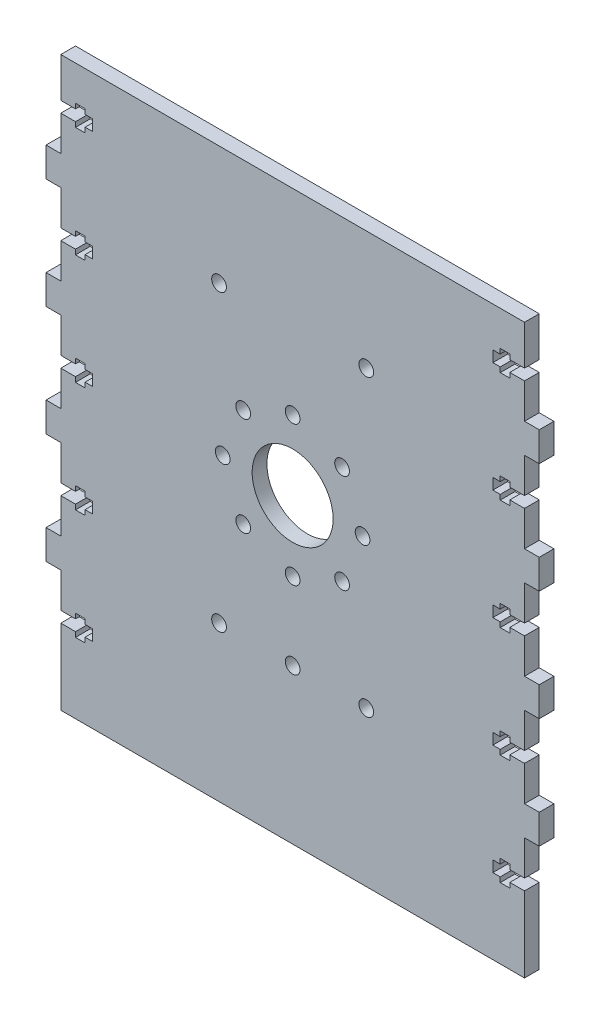
from build123d import *

# Parameters (mm, degrees)
SKETCH_1_R          = 2
SKETCH_1_R_2        = 11
EXTRUDE_1_DEPTH     = 4
SKETCH_3_W          = 126
SKETCH_3_H          = 2.7
CUT_EXTRUDE_1_DEPTH = 10


with BuildPart() as part:
    # 草图1 → 凸台-拉伸1 (new body)
    with BuildSketch(Plane.XY):
        Polygon((145, 46.5), (149, 46.5), (149, 45.15), (151.6, 45.15), (151.6, 46.5), (153.6, 46.5), (153.6, 49.5), (151.6, 49.5), (151.6, 50.85), (149, 50.85), (149, 49.5), (145, 49.5), (145, 59), (141, 59), (141, 67), (145, 67), (145, 76.5), (149, 76.5), (149, 75.15), (151.6, 75.15), (151.6, 76.5), (153.6, 76.5), (153.6, 79.5), (151.6, 79.5), (151.6, 80.85), (149, 80.85), (149, 79.5), (145, 79.5), (145, 89), (141, 89), (141, 97), (145, 97), (145, 106.5), (149, 106.5), (149, 105.15), (151.6, 105.15), (151.6, 106.5), (153.6, 106.5), (153.6, 109.5), (151.6, 109.5), (151.6, 110.85), (149, 110.85), (149, 109.5), (145, 109.5), (145, 123), (271, 123), (271, 109.5), (267, 109.5), (267, 110.85), (264.4, 110.85), (264.4, 109.5), (262.4, 109.5), (262.4, 106.5), (264.4, 106.5), (264.4, 105.15), (267, 105.15), (267, 106.5), (271, 106.5), (271, 97), (275, 97), (275, 89), (271, 89), (271, 79.5), (267, 79.5), (267, 80.85), (264.4, 80.85), (264.4, 79.5), (262.4, 79.5), (262.4, 76.5), (264.4, 76.5), (264.4, 75.15), (267, 75.15), (267, 76.5), (271, 76.5), (271, 67), (275, 67), (275, 59), (271, 59), (271, 49.5), (267, 49.5), (267, 50.85), (264.4, 50.85), (264.4, 49.5), (262.4, 49.5), (262.4, 46.5), (264.4, 46.5), (264.4, 45.15), (267, 45.15), (267, 46.5), (271, 46.5), (271, 37), (275, 37), (275, 29), (271, 29), (271, 19.5), (267, 19.5), (267, 20.85), (264.4, 20.85), (264.4, 19.5), (262.4, 19.5), (262.4, 16.5), (264.4, 16.5), (264.4, 15.15), (267, 15.15), (267, 16.5), (271, 16.5), (271, 7), (275, 7), (275, -1), (271, -1), (271, -10.5), (267, -10.5), (267, -9.15), (264.4, -9.15), (264.4, -10.5), (262.4, -10.5), (262.4, -13.5), (264.4, -13.5), (264.4, -14.85), (267, -14.85), (267, -13.5), (271, -13.5), (271, -27), (271, -34), (145, -34), (145, -27), (145, -13.5), (149, -13.5), (149, -14.85), (151.6, -14.85), (151.6, -13.5), (153.6, -13.5), (153.6, -10.5), (151.6, -10.5), (151.6, -9.15), (149, -9.15), (149, -10.5), (145, -10.5), (145, -1), (141, -1), (141, 7), (145, 7), (145, 16.5), (149, 16.5), (149, 15.15), (151.6, 15.15), (151.6, 16.5), (153.6, 16.5), (153.6, 19.5), (151.6, 19.5), (151.6, 20.85), (149, 20.85), (149, 19.5), (145, 19.5), (145, 29), (141, 29), (141, 37), (145, 37), align=None)
        with Locations((208, 29)):
            Circle(SKETCH_1_R, mode=Mode.SUBTRACT)
        with Locations((208, 48)):
            Circle(SKETCH_1_R_2, mode=Mode.SUBTRACT)
        with Locations((188, 8)):
            Circle(SKETCH_1_R, mode=Mode.SUBTRACT)
        with Locations((228, 8)):
            Circle(SKETCH_1_R, mode=Mode.SUBTRACT)
        with Locations((228, 88)):
            Circle(SKETCH_1_R, mode=Mode.SUBTRACT)
        with Locations((188, 88)):
            Circle(SKETCH_1_R, mode=Mode.SUBTRACT)
        with Locations((208, 8)):
            Circle(SKETCH_1_R, mode=Mode.SUBTRACT)
        with Locations((194.564971157, 34.564971157)):
            Circle(SKETCH_1_R, mode=Mode.SUBTRACT)
        with Locations((189, 48)):
            Circle(SKETCH_1_R, mode=Mode.SUBTRACT)
        with Locations((194.564971157, 61.435028843)):
            Circle(SKETCH_1_R, mode=Mode.SUBTRACT)
        with Locations((208, 67)):
            Circle(SKETCH_1_R, mode=Mode.SUBTRACT)
        with Locations((221.435028843, 61.435028843)):
            Circle(SKETCH_1_R, mode=Mode.SUBTRACT)
        with Locations((227, 48)):
            Circle(SKETCH_1_R, mode=Mode.SUBTRACT)
        with Locations((221.435028843, 34.564971157)):
            Circle(SKETCH_1_R, mode=Mode.SUBTRACT)
    extrude(amount=EXTRUDE_1_DEPTH)

    # 草图3 → 切除-拉伸1 (cut)
    with BuildSketch(Plane.XY.offset(4)):
        with Locations((208, 121.65)):
            Rectangle(SKETCH_3_W, SKETCH_3_H)
    extrude(amount=-CUT_EXTRUDE_1_DEPTH, mode=Mode.SUBTRACT)


solid = part.part
